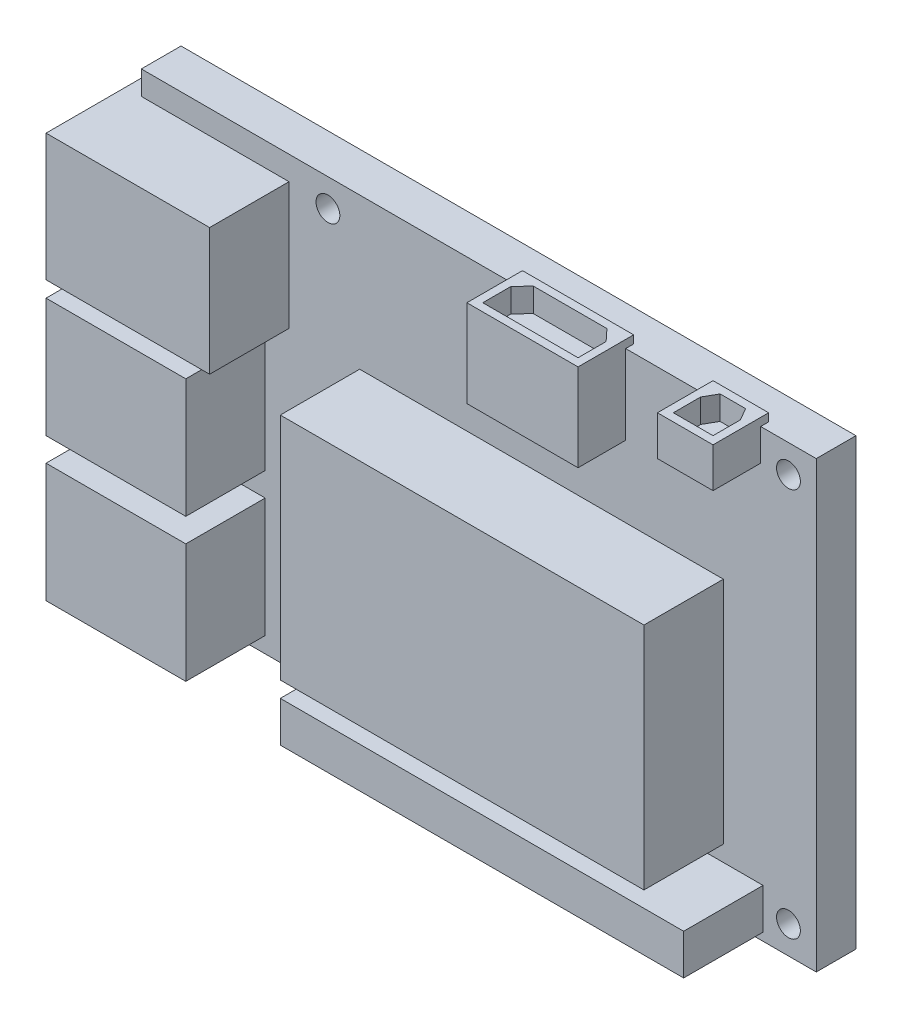
from build123d import *

# Parameters (mm, degrees)
CROQUIS1_W                   = 85
CROQUIS1_H                   = 56
CROQUIS1_R                   = 1.5
SALIENTE_EXTRUIR3_DEPTH      = 5
SALIENTE_EXTRUIR4_DEPTH      = 10
SALIENTE_EXTRUIR4_DEPTH_BACK = 3
CROQUIS2_W                   = 20.6
CROQUIS2_H                   = 16
CROQUIS3_W                   = 50.8
CROQUIS3_H                   = 5.1
SALIENTE_EXTRUIR5_DEPTH      = 10
CROQUIS4_W                   = 11
CROQUIS4_H                   = 14
CORTAR_EXTRUIR2_DEPTH        = 15
CROQUIS5_W                   = 45.8
CROQUIS5_H                   = 28.9
SALIENTE_EXTRUIR6_DEPTH      = 10
SALIENTE_EXTRUIR8_DEPTH      = 10
SALIENTE_EXTRUIR8_DEPTH_BACK = 3
CROQUIS6_W                   = 17.6
CROQUIS6_H                   = 15
CROQUIS7_W                   = 5
CROQUIS7_H                   = 13
CORTAR_EXTRUIR3_DEPTH        = 15
SALIENTE_EXTRUIR9_DEPTH      = 6
SALIENTE_EXTRUIR9_DEPTH_BACK = 1
CROQUIS8_W                   = 7
CROQUIS8_H                   = 5
CROQUIS8_W_2                 = 14
CROQUIS8_H_2                 = 11
CORTAR_EXTRUIR4_DEPTH        = 3


with BuildPart() as part:
    # Croquis1 → Saliente-Extruir3 (new body)
    with BuildSketch(Plane.XY):
        with Locations((42.5, 28)):
            Rectangle(CROQUIS1_W, CROQUIS1_H)
        with Locations((23.5, 52.5)):
            Circle(CROQUIS1_R, mode=Mode.SUBTRACT)
        with Locations((23.5, 3.5)):
            Circle(CROQUIS1_R, mode=Mode.SUBTRACT)
        with Locations((81.5, 52.5)):
            Circle(CROQUIS1_R, mode=Mode.SUBTRACT)
        with Locations((81.5, 3.5)):
            Circle(CROQUIS1_R, mode=Mode.SUBTRACT)
    extrude(amount=SALIENTE_EXTRUIR3_DEPTH)

    # Croquis2 → Saliente-Extruir4 (add, two sides: drawn at the far end of the back side and taken through both)
    with BuildSketch(Plane.XY.offset(5).offset(-SALIENTE_EXTRUIR4_DEPTH_BACK)):
        with Locations((8.3, 45)):
            Rectangle(CROQUIS2_W, CROQUIS2_H)
    extrude(amount=SALIENTE_EXTRUIR4_DEPTH + SALIENTE_EXTRUIR4_DEPTH_BACK)

    # Croquis3 → Saliente-Extruir5 (add)
    with BuildSketch(Plane.XY.offset(5)):
        with Locations((52.9, 3.55)):
            Rectangle(CROQUIS3_W, CROQUIS3_H)
    extrude(amount=SALIENTE_EXTRUIR5_DEPTH)

    # Croquis4 → Cortar-Extruir2 (cut)
    with BuildSketch(Plane.ZY.offset(2)):
        with Locations((8.5, 45)):
            Rectangle(CROQUIS4_W, CROQUIS4_H)
    extrude(amount=-CORTAR_EXTRUIR2_DEPTH, mode=Mode.SUBTRACT)

    # Croquis5 → Saliente-Extruir6 (add)
    with BuildSketch(Plane.XY.offset(5)):
        with Locations((50.4, 22.55)):
            Rectangle(CROQUIS5_W, CROQUIS5_H)
    extrude(amount=SALIENTE_EXTRUIR6_DEPTH)

    # Croquis6 → Saliente-Extruir8 (add, two sides: drawn at the far end of the back side and taken through both)
    with BuildSketch(Plane.XY.offset(5).offset(-SALIENTE_EXTRUIR8_DEPTH_BACK)):
        with Locations((6.8, 27.5)):
            Rectangle(CROQUIS6_W, CROQUIS6_H)
        with Locations((6.8, 9.5)):
            Rectangle(CROQUIS6_W, CROQUIS6_H)
    extrude(amount=SALIENTE_EXTRUIR8_DEPTH + SALIENTE_EXTRUIR8_DEPTH_BACK)

    # Croquis7 → Cortar-Extruir3 (cut)
    with BuildSketch(Plane.ZY.offset(2)):
        with Locations((5.5, 27.5)):
            Rectangle(CROQUIS7_W, CROQUIS7_H)
        with Locations((11.5, 27.5)):
            Rectangle(CROQUIS7_W, CROQUIS7_H)
        with Locations((11.5, 9.5)):
            Rectangle(CROQUIS7_W, CROQUIS7_H)
        with Locations((5.5, 9.5)):
            Rectangle(CROQUIS7_W, CROQUIS7_H)
    extrude(amount=-CORTAR_EXTRUIR3_DEPTH, mode=Mode.SUBTRACT)

    # Croquis8 → Saliente-Extruir9 (add, two sides: drawn at the far end of the back side and taken through both)
    with BuildSketch(Plane.XY.offset(5).offset(-SALIENTE_EXTRUIR9_DEPTH_BACK)):
        with Locations((74.5, 54.5)):
            Rectangle(CROQUIS8_W, CROQUIS8_H)
        with Locations((54, 51.5)):
            Rectangle(CROQUIS8_W_2, CROQUIS8_H_2)
    extrude(amount=SALIENTE_EXTRUIR9_DEPTH + SALIENTE_EXTRUIR9_DEPTH_BACK)

    # Croquis9 → Cortar-Extruir4 (cut)
    with BuildSketch(Plane(origin=(0, 57, 0), x_dir=(1, 0, 0), z_dir=(0, 1, 0))):
        Polygon((48, -10), (60, -10), (60, -6.462110536), (58.635363499, -5), (49.364636501, -5), (48, -6.462110536), align=None)
        Polygon((72, -10), (77, -10), (77, -6.561817621), (76.105167212, -5), (72.894832788, -5), (72, -6.561817621), align=None)
    extrude(amount=-CORTAR_EXTRUIR4_DEPTH, mode=Mode.SUBTRACT)


solid = part.part
